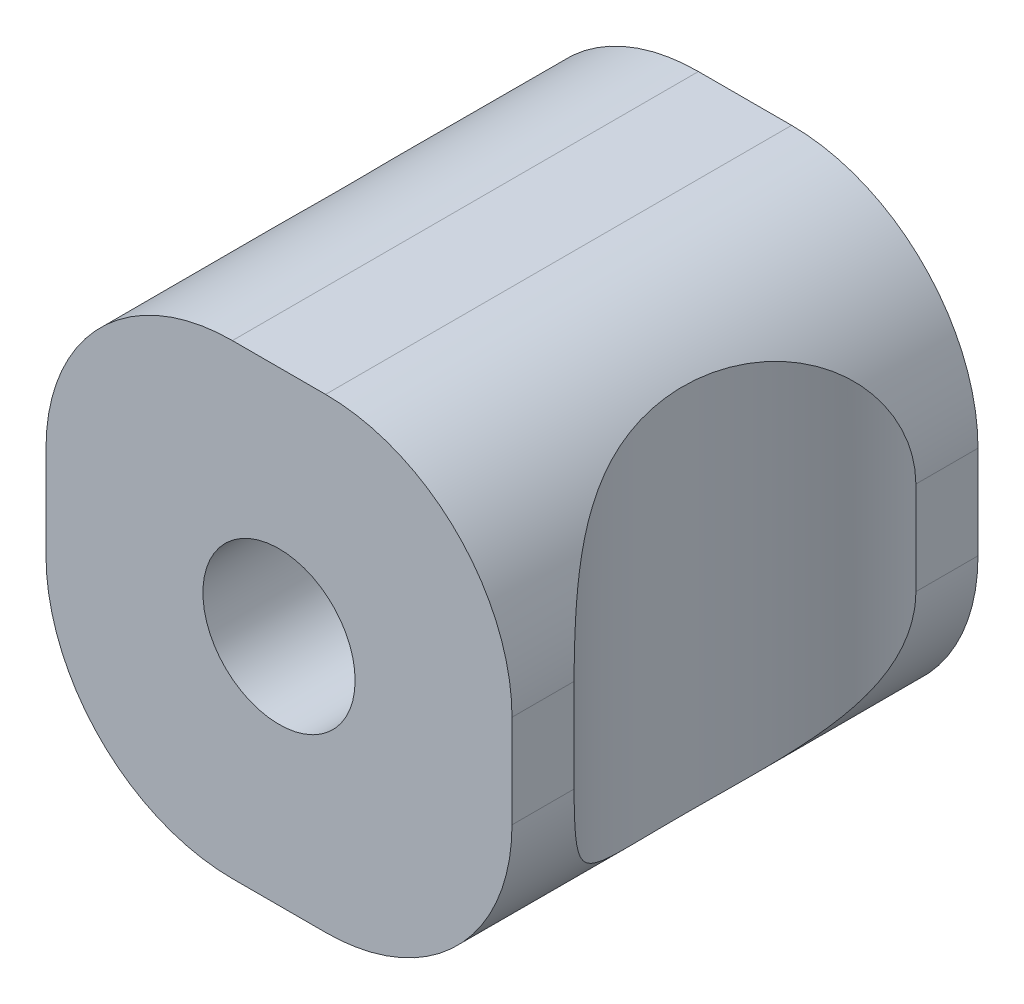
from build123d import *

# Parameters (mm, degrees)
BASE_SKETCH_W      = 15
BASE_SKETCH_H      = 15
BASE_DEPTH         = 15
NUT_HOLE_SKETCH_R  = 2.45
NUT_HOLE_DEPTH     = 10
ROUNDING_R         = 6
THUMB_HOLE_DEPTH   = 23.5
KRUHOV_POLE1_COUNT = 2


with BuildPart() as part:
    # Base sketch → Base (new body)
    with BuildSketch(Plane.XY):
        Rectangle(BASE_SKETCH_W, BASE_SKETCH_H)
    extrude(amount=BASE_DEPTH)

    # Nut hole sketch → Nut hole (cut)
    with BuildSketch(Plane.XY.offset(15)):
        Circle(NUT_HOLE_SKETCH_R)
    extrude(amount=-NUT_HOLE_DEPTH, mode=Mode.SUBTRACT)

    # Rounding
    rounding_edges = [part.edges().sort_by_distance(p)[0] for p in [
        (7.5, -7.5, 7.5),
        (-7.5, -7.5, 7.5),
        (-7.5, 7.5, 7.5),
        (7.5, 7.5, 7.5),
    ]]
    fillet(rounding_edges, radius=ROUNDING_R)

    # Thumb hole sketch → Thumb hole (cut, through all)
    with BuildSketch(Plane.XZ.offset(7.5)):
        with BuildLine():
            Line((-7.5, 13), (-7.5, 2))
            ThreePointArc((-7.5, 2), (-5.5, 7.5), (-7.5, 13))
        make_face()
    thumb_hole = extrude(amount=-THUMB_HOLE_DEPTH, mode=Mode.SUBTRACT)

    # Kruhové pole1: Thumb hole ×2 about axis
    kruhov_pole1_axis = Axis((0, 0, 7.5), (0, 1, 0))
    for i in range(1, KRUHOV_POLE1_COUNT):
        add(thumb_hole.rotate(kruhov_pole1_axis, i * 360 / KRUHOV_POLE1_COUNT), mode=Mode.SUBTRACT)


solid = part.part
